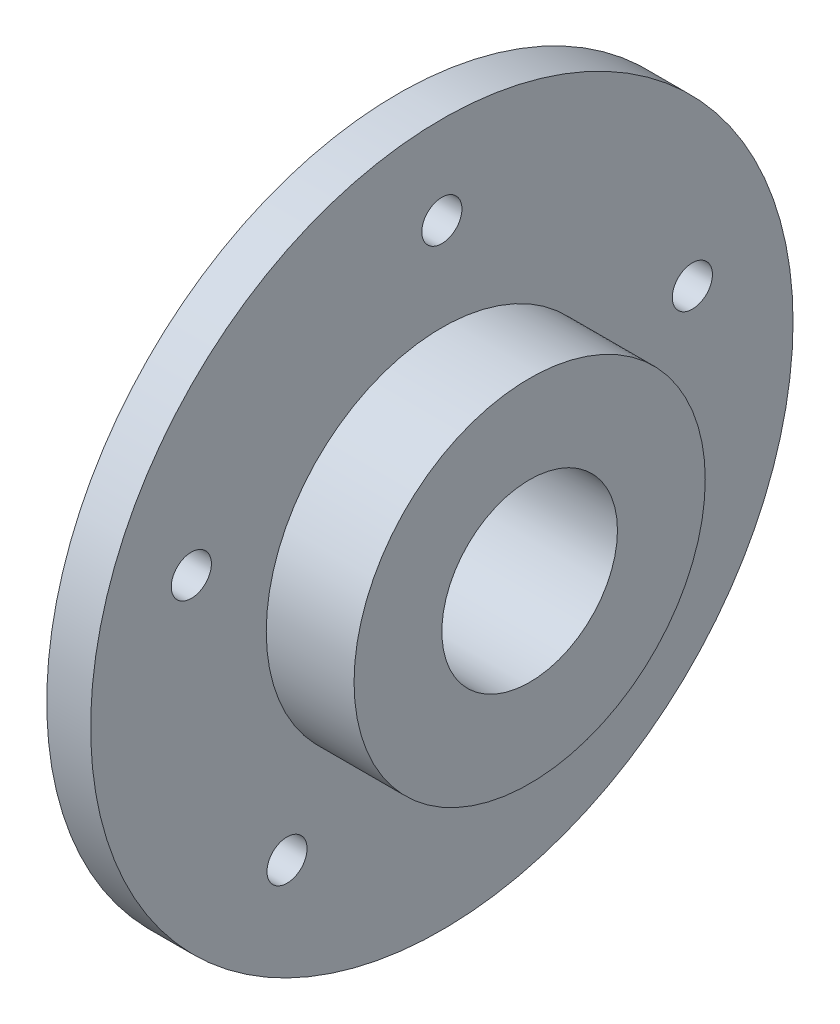
from build123d import *

# Parameters (mm, degrees)
SKETCH1_R           = 50.8
SKETCH1_R_2         = 2.9
BOSS_EXTRUDE1_DEPTH = 6.35
SKETCH2_R           = 25.4
BOSS_EXTRUDE2_DEPTH = 12.7
SKETCH3_R           = 12.7
CUT_EXTRUDE1_DEPTH  = 19.05


with BuildPart() as part:
    # Sketch1 → Boss-Extrude1 (new body)
    with BuildSketch(Plane(origin=(0, 0, 0), x_dir=(0, 0, -1), z_dir=(1, 0, 0))):
        with Locations((0, 0.711302035)):
            Circle(SKETCH1_R)
        with Locations((-36.235253271, 12.484849521)):
            Circle(SKETCH1_R_2, mode=Mode.SUBTRACT)
        with Locations((-22.394618112, -30.112245451)):
            Circle(SKETCH1_R_2, mode=Mode.SUBTRACT)
        with Locations((22.394618112, -30.112245451)):
            Circle(SKETCH1_R_2, mode=Mode.SUBTRACT)
        with Locations((36.235253271, 12.484849521)):
            Circle(SKETCH1_R_2, mode=Mode.SUBTRACT)
        with Locations((0, 38.811302035)):
            Circle(SKETCH1_R_2, mode=Mode.SUBTRACT)
    extrude(amount=BOSS_EXTRUDE1_DEPTH)

    # Sketch2 → Boss-Extrude2 (add)
    with BuildSketch(Plane(origin=(6.35, 0, 0), x_dir=(0, 0, -1), z_dir=(1, 0, 0))):
        Circle(SKETCH2_R)
    extrude(amount=BOSS_EXTRUDE2_DEPTH)

    # Sketch3 → Cut-Extrude1 (cut)
    with BuildSketch(Plane(origin=(19.05, 0, 0), x_dir=(0, 0, -1), z_dir=(1, 0, 0))):
        Circle(SKETCH3_R)
    extrude(amount=-CUT_EXTRUDE1_DEPTH, mode=Mode.SUBTRACT)


solid = part.part
